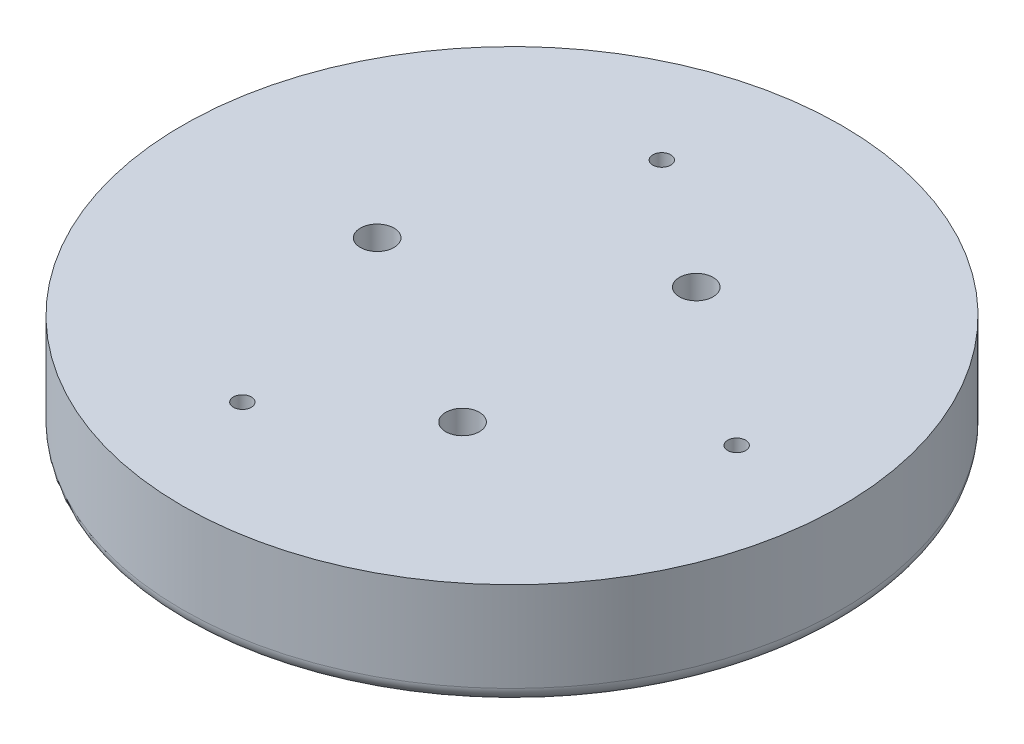
from build123d import *

# Parameters (mm, degrees)
SKETCH1_R           = 22
SKETCH1_R_2         = 0.6
SKETCH1_R_3         = 1.125
BOSS_EXTRUDE1_DEPTH = 7
FILLET1_R           = 1


with BuildPart() as part:
    # Sketch1 → Boss-Extrude1 (new body)
    with BuildSketch(Plane(origin=(0, 0, 0), x_dir=(1, 0, 0), z_dir=(0, 1, 0))):
        with Locations(Location((0, 0, 0), (0, 0, 270))):
            Circle(SKETCH1_R)
        with Locations(Location((-4, 14, 0), (0, 0, 270))):
            Circle(SKETCH1_R_2, mode=Mode.SUBTRACT)
        with Locations(Location((-4, -14, 0), (0, 0, 270))):
            Circle(SKETCH1_R_2, mode=Mode.SUBTRACT)
        with Locations(Location((15, 0, 0), (0, 0, 270))):
            Circle(SKETCH1_R_2, mode=Mode.SUBTRACT)
        with Locations(Location((-9, 0, 0), (0, 0, 270))):
            Circle(SKETCH1_R_3, mode=Mode.SUBTRACT)
        with Locations(Location((4.5, 7.8, 0), (0, 0, 270))):
            Circle(SKETCH1_R_3, mode=Mode.SUBTRACT)
        with Locations(Location((4.5, -7.8, 0), (0, 0, 270))):
            Circle(SKETCH1_R_3, mode=Mode.SUBTRACT)
    extrude(amount=BOSS_EXTRUDE1_DEPTH)

    # Fillet1
    fillet1_edges = [part.edges().sort_by_distance(p)[0] for p in [
        (0, 0, -22),
    ]]
    fillet(fillet1_edges, radius=FILLET1_R)


solid = part.part
